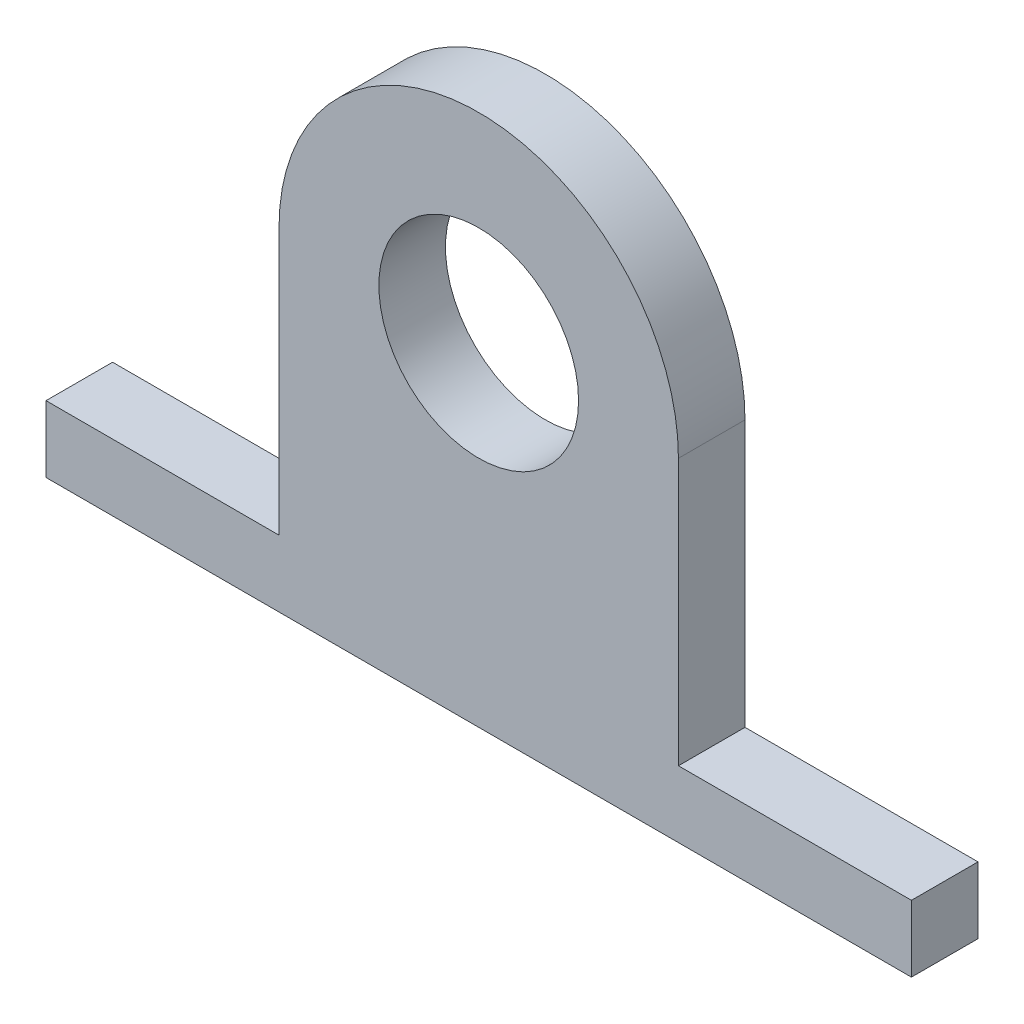
from build123d import *

# Parameters (mm, degrees)
ESQUISSE1_R        = 15
BOSS_EXTRU_1_DEPTH = 10


with BuildPart() as part:
    # Esquisse1 → Boss.-Extru.1 (new body)
    with BuildSketch(Plane.XY):
        with BuildLine():
            Line((-65, 0), (65, 0))
            Line((65, 0), (65, 10))
            Line((65, 10), (30, 10))
            Line((30, 10), (30, 50))
            ThreePointArc((30, 50), (0, 80), (-30, 50))
            Line((-30, 50), (-30, 10))
            Line((-30, 10), (-65, 10))
            Line((-65, 10), (-65, 0))
        make_face()
        with Locations((0, 50)):
            Circle(ESQUISSE1_R, mode=Mode.SUBTRACT)
    extrude(amount=BOSS_EXTRU_1_DEPTH)


solid = part.part
